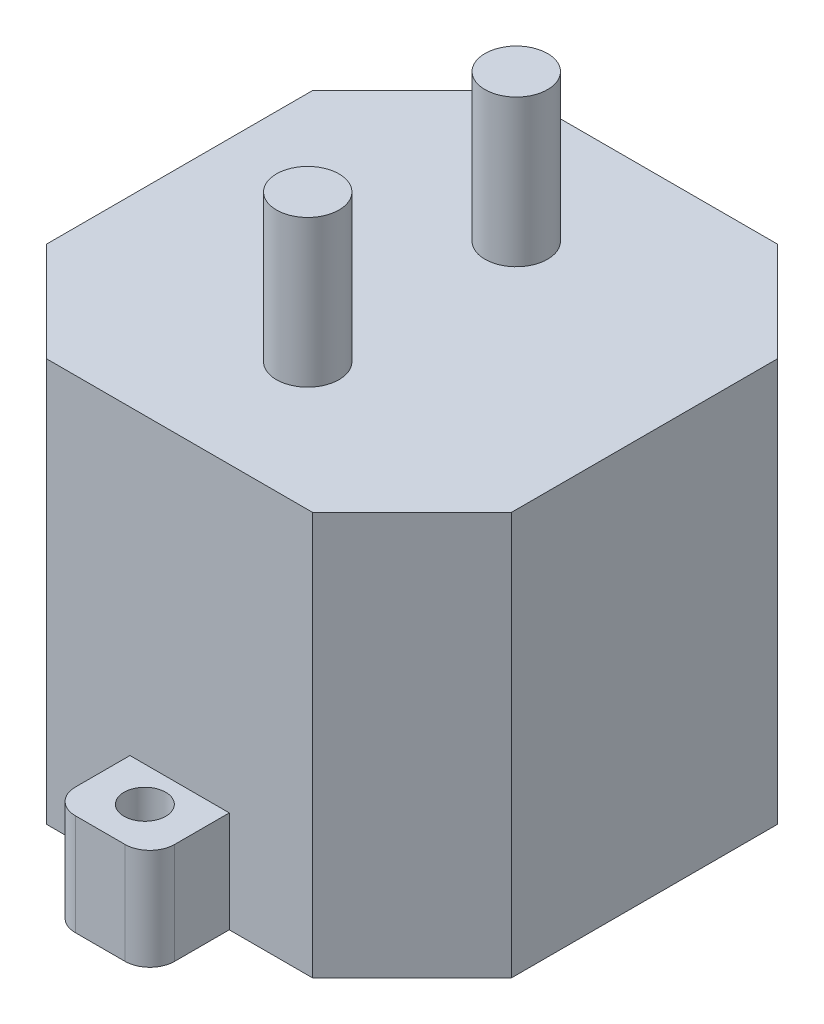
from build123d import *

# Parameters (mm, degrees)
BOSS_EXTRUDE1_DEPTH = 12.954
BOSS_EXTRUDE2_DEPTH = 38.608
SKETCH3_R           = 2.667
CUT_EXTRUDE1_DEPTH  = 100.331862844
FILLET1_R           = 3.175
SKETCH4_R           = 4
BOSS_EXTRUDE3_DEPTH = 18.796


with BuildPart() as part:
    # Sketch1 → Boss-Extrude1 (new body)
    with BuildSketch(Plane(origin=(0, 0, 0), x_dir=(1, 0, 0), z_dir=(0, 1, 0))):
        Polygon((36.068, 0), (29.718, 0), (23.368, 0), (23.368, -10.16), (36.068, -10.16), align=None)
        Polygon((36.068, 59.436), (29.718, 59.436), (29.718, 0), (36.068, 0), (46.736, 0), (59.436, 12.7), (59.436, 46.736), (46.736, 59.436), align=None)
        Polygon((29.718, 0), (29.718, 59.436), (23.368, 59.436), (12.7, 59.436), (0, 46.736), (0, 12.7), (12.7, 0), (23.368, 0), align=None)
        Polygon((23.368, 59.436), (29.718, 59.436), (36.068, 59.436), (36.068, 69.596), (23.368, 69.596), align=None)
    extrude(amount=BOSS_EXTRUDE1_DEPTH)

    # Sketch2 → Boss-Extrude2 (add)
    with BuildSketch(Plane(origin=(0, 12.954, 0), x_dir=(1, 0, 0), z_dir=(0, 1, 0))):
        Polygon((23.368, 59.436), (36.068, 59.436), (46.736, 59.436), (59.436, 46.736), (59.436, 12.7), (46.736, 0), (36.068, 0), (23.368, 0), (12.7, 0), (0, 12.7), (0, 46.736), (12.7, 59.436), align=None)
    extrude(amount=BOSS_EXTRUDE2_DEPTH)

    # Sketch3 → Cut-Extrude1 (cut, through all)
    with BuildSketch(Plane(origin=(0, 12.954, 0), x_dir=(1, 0, 0), z_dir=(0, 1, 0))):
        with Locations(Location((29.718, 63.881, 0), (0, 0, 270))):
            Circle(SKETCH3_R)
        with Locations(Location((29.718, -4.445, 0), (0, 0, 270))):
            Circle(SKETCH3_R)
    extrude(amount=-CUT_EXTRUDE1_DEPTH, mode=Mode.SUBTRACT)

    # Fillet1
    fillet1_edges = [part.edges().sort_by_distance(p)[0] for p in [
        (36.068, 6.477, 10.16),
        (23.368, 6.477, 10.16),
        (23.368, 6.477, -69.596),
        (36.068, 6.477, -69.596),
    ]]
    fillet(fillet1_edges, radius=FILLET1_R)

    # Sketch4 → Boss-Extrude3 (add)
    with BuildSketch(Plane(origin=(0, 51.562, 0), x_dir=(1, 0, 0), z_dir=(0, 1, 0))):
        with Locations(Location((29.718, 43.053, 0), (0, 0, 270))):
            Circle(SKETCH4_R)
        with Locations(Location((29.718, 16.383, 0), (0, 0, 270))):
            Circle(SKETCH4_R)
    extrude(amount=BOSS_EXTRUDE3_DEPTH)


solid = part.part
